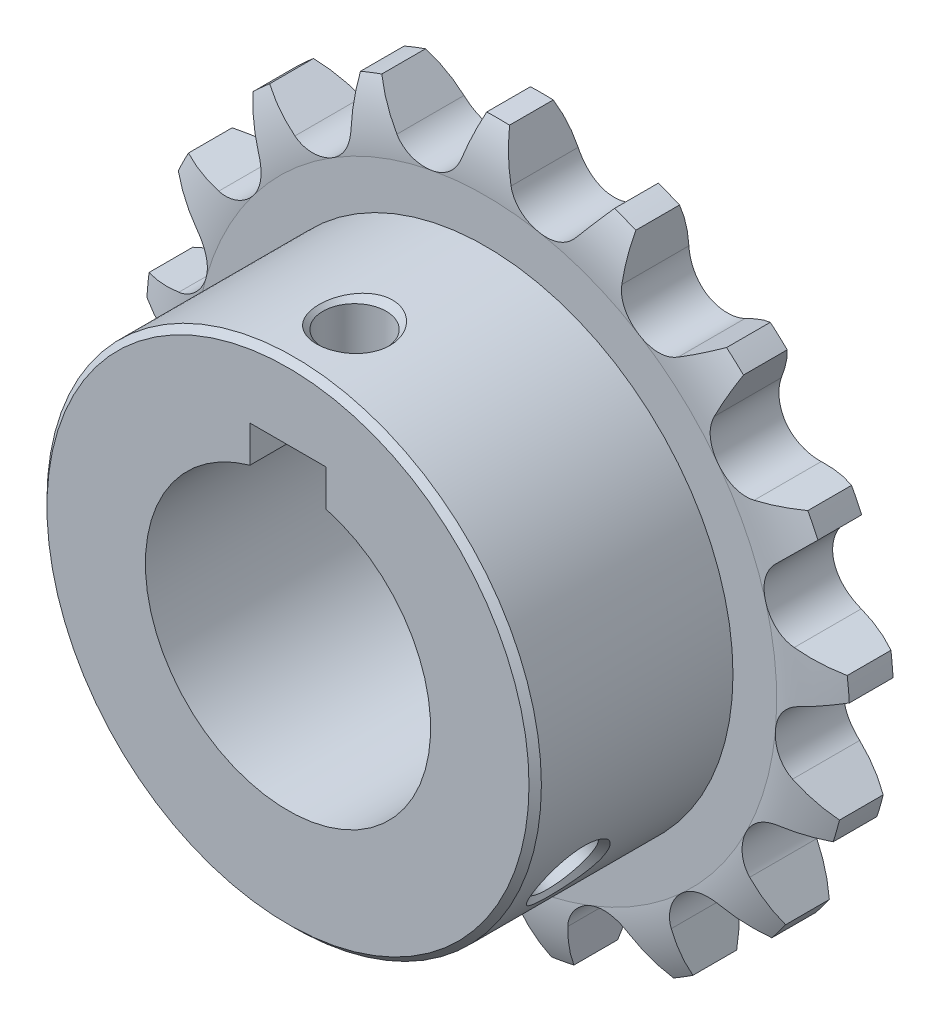
from build123d import *

# Parameters (mm, degrees)
CUT_EXTRUDE1_DEPTH      = 7.3
CUT_EXTRUDE1_DEPTH_BACK = 7.3
SKETCH2_R               = 69.11
SKETCH5_W               = 8
SKETCH5_H               = 18.3
CUT_EXTRUDE2_DEPTH      = 28


with BuildPart() as part:
    # Sketch1 → Revolve1 (revolve)
    with BuildSketch(Plane(origin=(0, 0, 0), x_dir=(0, 0, -1), z_dir=(1, 0, 0)), mode=Mode.PRIVATE) as revolve1_sk:
        with BuildLine():
            Line((-28, 25.35), (-28, 15))
            Line((-28, 15), (0, 15))
            Line((0, 15), (0, 30.6))
            ThreePointArc((0, 30.6), (-0.241563783, 33.882963607), (-1.3, 37))
            Line((-1.3, 37), (-5.9, 37))
            ThreePointArc((-5.9, 37), (-6.958436217, 33.882963607), (-7.2, 30.6))
            Line((-7.2, 30.6), (-7.2, 26))
            Line((-7.2, 26), (-27.35, 26))
            Line((-27.35, 26), (-28, 25.35))
        make_face()
    revolve(revolve1_sk.sketch.rotate(Axis((0, 0, 0), (0, 0, 1)), 270), axis=Axis((0, 0, 0), (0, 0, 1)))

    # Sketch2 → Cut-Extrude1 (cut, two sides: drawn at the far end of the back side and taken through both)
    with BuildSketch(Plane.XY.offset(-CUT_EXTRUDE1_DEPTH_BACK)):
        Circle(SKETCH2_R)
        with BuildLine():
            Line((-36.952400512, 2.224293523), (-32.837483958, 0.447097075))
            ThreePointArc((-32.837483958, 0.447097075), (-30.464487124, -2.822950458), (-32.19620952, -6.473356242))
            Line((-32.19620952, -6.473356242), (-35.914502809, -8.976406475))
            Line((-35.914502809, -8.976406475), (-35.260594785, -11.27465479))
            Line((-35.260594785, -11.27465479), (-30.781551967, -11.445361812))
            ThreePointArc((-30.781551967, -11.445361812), (-27.387520899, -13.637364995), (-27.683625275, -17.666837298))
            Line((-27.683625275, -17.666837298), (-30.246624471, -21.344064593))
            Line((-30.246624471, -21.344064593), (-28.806650348, -23.250898499))
            Line((-28.806650348, -23.250898499), (-24.568400816, -21.792061165))
            ThreePointArc((-24.568400816, -21.792061165), (-20.611718217, -22.609977822), (-19.432214036, -26.474314082))
            Line((-19.432214036, -26.474314082), (-20.493771895, -30.829088516))
            Line((-20.493771895, -30.829088516), (-18.462208157, -32.086979528))
            Line((-18.462208157, -32.086979528), (-15.037150997, -29.195621904))
            ThreePointArc((-15.037150997, -29.195621904), (-11.052188777, -28.528987859), (-8.556374614, -31.706288051))
            Line((-8.556374614, -31.706288051), (-7.973121866, -36.150473205))
            Line((-7.973121866, -36.150473205), (-5.624342453, -36.589536171))
            Line((-5.624342453, -36.589536171), (-3.475050612, -32.656152127))
            ThreePointArc((-3.475050612, -32.656152127), (0, -30.595), (3.475050612, -32.656152127))
            Line((3.475050612, -32.656152127), (5.624342453, -36.589536171))
            Line((5.624342453, -36.589536171), (7.973121866, -36.150473205))
            Line((7.973121866, -36.150473205), (8.556374614, -31.706288051))
            ThreePointArc((8.556374614, -31.706288051), (11.052188777, -28.528987859), (15.037150997, -29.195621904))
            Line((15.037150997, -29.195621904), (18.462208157, -32.086979528))
            Line((18.462208157, -32.086979528), (20.493771895, -30.829088516))
            Line((20.493771895, -30.829088516), (19.432214036, -26.474314082))
            ThreePointArc((19.432214036, -26.474314082), (20.611718217, -22.609977822), (24.568400816, -21.792061165))
            Line((24.568400816, -21.792061165), (28.806650348, -23.250898499))
            Line((28.806650348, -23.250898499), (30.246624471, -21.344064593))
            Line((30.246624471, -21.344064593), (27.683625275, -17.666837298))
            ThreePointArc((27.683625275, -17.666837298), (27.387520899, -13.637364995), (30.781551967, -11.445361812))
            Line((30.781551967, -11.445361812), (35.260594785, -11.27465479))
            Line((35.260594785, -11.27465479), (35.914502809, -8.976406475))
            Line((35.914502809, -8.976406475), (32.19620952, -6.473356242))
            ThreePointArc((32.19620952, -6.473356242), (30.464487124, -2.822950458), (32.837483958, 0.447097075))
            Line((32.837483958, 0.447097075), (36.952400512, 2.224293523))
            Line((36.952400512, 2.224293523), (36.731928534, 4.603565077))
            Line((36.731928534, 4.603565077), (32.360517264, 5.594387446))
            ThreePointArc((32.360517264, 5.594387446), (29.427055553, 8.372719181), (30.458531782, 12.279173025))
            Line((30.458531782, 12.279173025), (33.653579788, 15.422838671))
            Line((33.653579788, 15.422838671), (32.588503772, 17.561799656))
            Line((32.588503772, 17.561799656), (28.154357836, 16.906578109))
            ThreePointArc((28.154357836, 16.906578109), (24.415337069, 18.4376067), (23.965986112, 22.452878616))
            Line((23.965986112, 22.452878616), (25.809656634, 26.538443995))
            Line((25.809656634, 26.538443995), (24.043820996, 28.148215879))
            Line((24.043820996, 28.148215879), (20.145796373, 25.935441716))
            ThreePointArc((20.145796373, 25.935441716), (16.106192023, 26.012393268), (14.236701218, 29.594198535))
            Line((14.236701218, 29.594198535), (14.479996335, 34.069885403))
            Line((14.479996335, 34.069885403), (12.251886963, 34.933059573))
            Line((12.251886963, 34.933059573), (9.416433478, 31.461580206))
            ThreePointArc((9.416433478, 31.461580206), (5.621816498, 30.074061985), (2.584670936, 32.738657954))
            Line((2.584670936, 32.738657954), (1.194732294, 37))
            Line((1.194732294, 37), (-1.194732294, 37))
            Line((-1.194732294, 37), (-2.584670936, 32.738657954))
            ThreePointArc((-2.584670936, 32.738657954), (-5.621816498, 30.074061985), (-9.416433478, 31.461580206))
            Line((-9.416433478, 31.461580206), (-12.251886963, 34.933059573))
            Line((-12.251886963, 34.933059573), (-14.479996335, 34.069885403))
            Line((-14.479996335, 34.069885403), (-14.236701218, 29.594198535))
            ThreePointArc((-14.236701218, 29.594198535), (-16.106192023, 26.012393268), (-20.145796373, 25.935441716))
            Line((-20.145796373, 25.935441716), (-24.043820996, 28.148215879))
            Line((-24.043820996, 28.148215879), (-25.809656634, 26.538443995))
            Line((-25.809656634, 26.538443995), (-23.965986112, 22.452878616))
            ThreePointArc((-23.965986112, 22.452878616), (-24.415337069, 18.4376067), (-28.154357836, 16.906578109))
            Line((-28.154357836, 16.906578109), (-32.588503772, 17.561799656))
            Line((-32.588503772, 17.561799656), (-33.653579788, 15.422838671))
            Line((-33.653579788, 15.422838671), (-30.458531782, 12.279173025))
            ThreePointArc((-30.458531782, 12.279173025), (-29.427055553, 8.372719181), (-32.360517264, 5.594387446))
            Line((-32.360517264, 5.594387446), (-36.731928534, 4.603565077))
            Line((-36.731928534, 4.603565077), (-36.952400512, 2.224293523))
        make_face(mode=Mode.SUBTRACT)
    extrude(amount=CUT_EXTRUDE1_DEPTH + CUT_EXTRUDE1_DEPTH_BACK, mode=Mode.SUBTRACT)

    # Sketch3 → Cut-Revolve1 (revolve, cut)
    with BuildSketch(Plane.XY.offset(21), mode=Mode.PRIVATE) as cut_revolve1_sk:
        Polygon((0, 14.5), (-3.3235, 14.5), (-3.3235, 25.3235), (-4, 26), (0, 26), align=None)
    revolve(cut_revolve1_sk.sketch.rotate(Axis((0, 26, 21), (0, -1, 0)), 180), axis=Axis((0, 26, 21), (0, -1, 0)), mode=Mode.SUBTRACT)

    # Sketch4 → Cut-Revolve2 (revolve, cut)
    with BuildSketch(Plane.XY.offset(21), mode=Mode.PRIVATE) as cut_revolve2_sk:
        Polygon((0, 0), (1.66175, 2.878235429), (23.592544313, -9.783514571), (24.516660498, -9.535898385), (22.516660498, -13), align=None)
    revolve(cut_revolve2_sk.sketch.rotate(Axis((22.516660498, -13, 21), (-0.8660254037844386, 0.5000000000000001, 0)), 180), axis=Axis((22.516660498, -13, 21), (-0.8660254037844386, 0.5000000000000001, 0)), mode=Mode.SUBTRACT)

    # Sketch5 → Cut-Extrude2 (cut)
    with BuildSketch(Plane.XY):
        with Locations((0, 9.15)):
            Rectangle(SKETCH5_W, SKETCH5_H)
    extrude(amount=CUT_EXTRUDE2_DEPTH, mode=Mode.SUBTRACT)


solid = part.part
